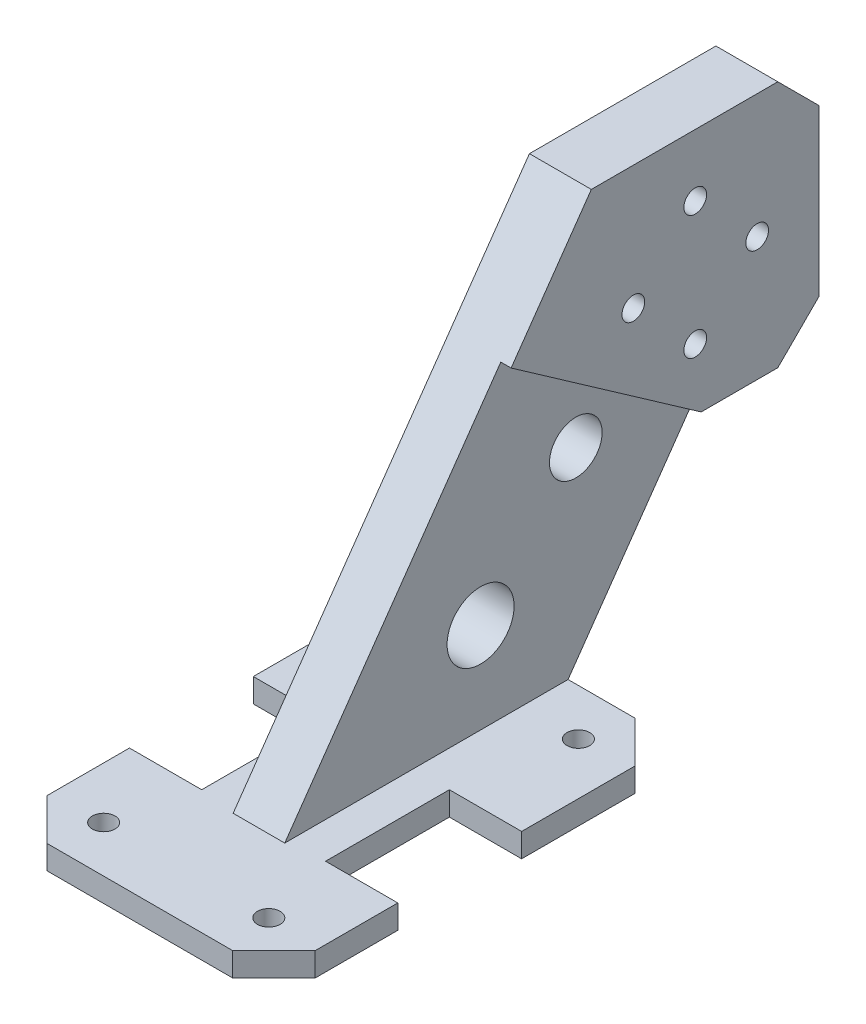
from build123d import *

# Parameters (mm, degrees)
EXTRUDE_1_DEPTH      = 30
SKETCH_2_R           = 8.25
CUT_EXTRUDE_1_DEPTH  = 2.5
EXTRUDE_2_DEPTH      = 41
SKETCH_6_R           = 8
CUT_EXTRUDE_3_DEPTH  = 4
CUT_EXTRUDE_4_DEPTH  = 83.710337927
CUT_EXTRUDE_6_DEPTH  = 23
EXTRUDE_3_DEPTH      = 23
CUT_EXTRUDE_7_DEPTH  = 46.5
EXTRUDE_4_DEPTH      = 4
CUT_EXTRUDE_8_DEPTH  = 23
CUT_EXTRUDE_9_DEPTH  = 65.964988157
SKETCH_16_R          = 1.25
CUT_EXTRUDE_10_DEPTH = 65.964988157
CUT_EXTRUDE_11_DEPTH = 44
EXTRUDE_5_DEPTH      = 2.5
CUT_EXTRUDE_12_DEPTH = 3
EXTRUDE_6_DEPTH      = 41
CUT_EXTRUDE_13_DEPTH = 41
CUT_EXTRUDE_14_DEPTH = 17
CHAMFER_1_SIZE       = 4
CUT_EXTRUDE_16_DEPTH = 53.085522264
EXTRUDE_8_DEPTH      = 5
CUT_EXTRUDE_17_DEPTH = 4
SKETCH_30_W          = 26
SKETCH_30_H          = 39
SKETCH_30_R          = 1.1
EXTRUDE_10_DEPTH     = 2.3
CHAMFER_4_SIZE       = 4
SKETCH_32_R          = 2.551786445
SKETCH_32_R_2        = 3.249198584
CUT_EXTRUDE_18_DEPTH = 48.085687781
SKETCH_33_W          = 7
SKETCH_33_H          = 12
CUT_EXTRUDE_19_DEPTH = 10
EXTRUDE_11_DEPTH     = 1
SKETCH_8_R           = 1.1
CUT_EXTRUDE_5_DEPTH  = 47.322910032


with BuildPart() as part:
    # 草图1 → 凸台-拉伸1 (new body)
    with BuildSketch(Plane(origin=(0, 0, 0), x_dir=(1, 0, 0), z_dir=(0, 1, 0))):
        Polygon((0, 0), (-15.325055808, 0), (-21.84047557, -15.349367059), (5.774670034, -27.071300914), (30, 30), (0, 30), align=None)
    extrude(amount=EXTRUDE_1_DEPTH)

    # 草图2 → 切除-拉伸1 (cut)
    with BuildSketch(Plane.ZY):
        with Locations((-15, 15)):
            Circle(SKETCH_2_R)
    extrude(amount=-CUT_EXTRUDE_1_DEPTH, mode=Mode.SUBTRACT)

    # 草图5 → 凸台-拉伸2 (add)
    with BuildSketch(Plane.XZ):
        Polygon((-21.84047557, 15.349367059), (-9.337079458, -14.106788251), (18.278066145, -2.384854396), (5.774670034, 27.071300914), align=None)
    extrude(amount=EXTRUDE_2_DEPTH)

    # 草图6 → 切除-拉伸3 (cut)
    with BuildSketch(Plane.XZ.offset(41)):
        with Locations(Location((-1.781204712, 6.482256331, 0), (0, 0, 270))):
            Circle(SKETCH_6_R)
    extrude(amount=-CUT_EXTRUDE_3_DEPTH, mode=Mode.SUBTRACT)

    # 草图7 → 切除-拉伸4 (cut, through all)
    with BuildSketch(Plane(origin=(0, 30, 0), x_dir=(1, 0, 0), z_dir=(0, 1, 0))):
        Polygon((0, 27), (5, 27), (5, -28.896309146), (30, 30), (0, 30), align=None)
    extrude(amount=-CUT_EXTRUDE_4_DEPTH, mode=Mode.SUBTRACT)

    # 草图10 → 切除-拉伸6 (cut)
    with BuildSketch(Plane.XZ.offset(41)):
        Polygon((-19.999465863, 16.130829316), (-7.496069751, -13.325325994), (-9.337079458, -14.106788251), (-21.84047557, 15.349367059), align=None)
        Polygon((5.774670034, 27.071300914), (3.933660327, 26.289838657), (16.437056438, -3.166316653), (18.278066145, -2.384854396), align=None)
    extrude(amount=-CUT_EXTRUDE_6_DEPTH, mode=Mode.SUBTRACT)

    # 草图11 → 凸台-拉伸3 (add)
    with BuildSketch(Plane.XZ.offset(41)):
        Polygon((-19.999465863, 16.130829316), (-24.297508276, 26.256382704), (-0.364382087, 36.415392045), (3.933660327, 26.289838657), align=None)
        Polygon((5, 23.777699815), (16.437056438, -3.166316653), (5, -8.021059083), align=None)
    extrude(amount=-EXTRUDE_3_DEPTH)

    # 草图12 → 切除-拉伸7 (cut)
    with BuildSketch(Plane.XZ.offset(41)):
        Polygon((0.345866355, -31.799769722), (-9.058994265, -9.64330658), (14.874131924, 0.51570276), (24.278992544, -21.640760381), align=None)
    extrude(amount=-CUT_EXTRUDE_7_DEPTH, mode=Mode.SUBTRACT)

    # 草图13 → 凸台-拉伸4 (add)
    with BuildSketch(Plane(origin=(0, -18, 0), x_dir=(1, 0, 0), z_dir=(0, 1, 0))):
        Polygon((14.874131924, -0.51570276), (-9.058994265, 9.64330658), (-24.297508276, -26.256382704), (-0.364382087, -36.415392045), align=None)
    extrude(amount=EXTRUDE_4_DEPTH)

    # 草图14 → 切除-拉伸8 (cut)
    with BuildSketch(Plane.XZ.offset(41)):
        Polygon((-9.058994265, -9.64330658), (14.874131924, 0.51570276), (-0.364382087, 36.415392045), (-24.297508276, 26.256382704), align=None)
    extrude(amount=-CUT_EXTRUDE_8_DEPTH, mode=Mode.SUBTRACT)

    # 草图15 → 切除-拉伸9 (cut, through all)
    with BuildSketch(Plane.XZ.offset(18)):
        Polygon((5, 23.777699815), (5, 26.742472994), (3.933660327, 26.289838657), align=None)
        Polygon((-19.999465863, 16.130829316), (-7.496069751, -13.325325994), (-9.337079458, -14.106788251), (-21.84047557, 15.349367059), align=None)
    extrude(amount=-CUT_EXTRUDE_9_DEPTH, mode=Mode.SUBTRACT)

    # 草图16 → 切除-拉伸10 (cut, through all)
    with BuildSketch(Plane.XZ.offset(18)):
        with Locations(Location((-17.936693931, 24.067766506, 0), (0, 0, 270))):
            Circle(SKETCH_16_R)
        with Locations(Location((-3.208616276, 30.319464562, 0), (0, 0, 90))):
            Circle(SKETCH_16_R)
        with Locations(Location((8.513317579, 2.704318958, 0), (0, 0, 270))):
            Circle(SKETCH_16_R)
        with Locations(Location((-6.214760076, -3.547379097, 0), (0, 0, 270))):
            Circle(SKETCH_16_R)
    extrude(amount=-CUT_EXTRUDE_10_DEPTH, mode=Mode.SUBTRACT)

    # 草图17 → 切除-拉伸11 (cut)
    with BuildSketch(Plane(origin=(0, 30, 0), x_dir=(1, 0, 0), z_dir=(0, 1, 0))):
        Polygon((-9.058994265, 9.64330658), (-19.999465863, -16.130829316), (0, -24.620098913), (0, 5.797991655), align=None)
    extrude(amount=-CUT_EXTRUDE_11_DEPTH, mode=Mode.SUBTRACT)

    # 草图18 → 凸台-拉伸5 (add)
    with BuildSketch(Plane.XZ.offset(-5.5)):
        Polygon((5, -3.675617573), (0, -5.797991655), (0, -27), (5, -27), align=None)
    extrude(amount=EXTRUDE_5_DEPTH)

    # 草图20 → 切除-拉伸12 (cut)
    with BuildSketch(Plane(origin=(0, 30, 0), x_dir=(1, 0, 0), z_dir=(0, 1, 0))):
        Polygon((0, 27), (0, -24.620098913), (3.933660327, -26.289838657), (5, -23.777699815), (5, 27), align=None)
    extrude(amount=-CUT_EXTRUDE_12_DEPTH, mode=Mode.SUBTRACT)

    # 草图21 → 凸台-拉伸6 (add)
    with BuildSketch(Plane(origin=(0, 27, 0), x_dir=(1, 0, 0), z_dir=(0, 1, 0))):
        Polygon((0, -24.620098913), (0, -35.556961644), (3.933660327, -26.289838657), align=None)
    extrude(amount=-EXTRUDE_6_DEPTH)

    # 草图22 → 切除-拉伸13 (cut)
    with BuildSketch(Plane(origin=(0, 27, 0), x_dir=(1, 0, 0), z_dir=(0, 1, 0))):
        Polygon((5, -23.777699815), (0, -23.777699815), (0, -35.556961644), align=None)
    extrude(amount=-CUT_EXTRUDE_13_DEPTH, mode=Mode.SUBTRACT)

    # 草图23 → 切除-拉伸14 (cut)
    with BuildSketch(Plane.XZ.offset(-3)):
        Polygon((5, -3.675617573), (0, -3.675617573), (0, -5.797991655), align=None)
    extrude(amount=CUT_EXTRUDE_14_DEPTH, mode=Mode.SUBTRACT)

    # 倒角1
    chamfer_1_edges = [part.edges().sort_by_distance(p)[0] for p in [
        (-24.297508276, -16, 26.256382704),
        (-0.364382087, -16, 36.415392045),
        (14.874131924, -16, 0.51570276),
        (-9.058994265, -16, -9.64330658),
        (2.5, 3, -27),
        (2.5, 27, -27),
    ]]
    chamfer(chamfer_1_edges, length=CHAMFER_1_SIZE)

    # 草图26 → 切除-拉伸16 (cut, through all)
    with BuildSketch(Plane(origin=(5, 0, 0), x_dir=(0, 0, -1), z_dir=(1, 0, 0))):
        Polygon((-23.777699815, -14), (4.930809251, 27), (-23.777699815, 27), align=None)
    extrude(amount=-CUT_EXTRUDE_16_DEPTH, mode=Mode.SUBTRACT)

    # 草图27 → 凸台-拉伸8 (add)
    with BuildSketch(Plane(origin=(5, 0, 0), x_dir=(0, 0, -1), z_dir=(1, 0, 0))):
        Polygon((3.675617573, -14), (15.579145723, 3), (3.675617573, 3), align=None)
    extrude(amount=-EXTRUDE_8_DEPTH)

    # 草图31 → 切除-拉伸17 (cut)
    with BuildSketch(Plane.XZ.offset(18)):
        Polygon((-5.376974851, -8.080382066), (11.192112511, -1.047221754), (13.311207411, 4.197722174), (1.198542427, 32.733372631), (-4.0464015, 34.852467531), (-20.615488863, 27.819307218), (-22.734583762, 22.574363291), (-10.621918779, -5.961287167), align=None)
    extrude(amount=-CUT_EXTRUDE_17_DEPTH, mode=Mode.SUBTRACT)

    # 草图30 → 凸台-拉伸10 (add)
    with BuildSketch(Plane(origin=(0, -14, 0), x_dir=(1, 0, 0), z_dir=(0, 1, 0))):
        with Locations((2.5, -15.824382427)):
            Rectangle(SKETCH_30_W, SKETCH_30_H)
        with Locations(Location((-5.5, -0.824382427, 0), (0, 0, 270))):
            Circle(SKETCH_30_R, mode=Mode.SUBTRACT)
        with Locations(Location((10.5, -0.824382427, 0), (0, 0, 90))):
            Circle(SKETCH_30_R, mode=Mode.SUBTRACT)
        with Locations(Location((10.5, -30.824382427, 0), (0, 0, 270))):
            Circle(SKETCH_30_R, mode=Mode.SUBTRACT)
        with Locations(Location((-5.5, -30.824382427, 0), (0, 0, 90))):
            Circle(SKETCH_30_R, mode=Mode.SUBTRACT)
    extrude(amount=-EXTRUDE_10_DEPTH)

    # 倒角4
    chamfer_4_edges = [part.edges().sort_by_distance(p)[0] for p in [
        (-10.5, -15.15, 35.324382427),
        (-10.5, -15.15, -3.675617573),
        (15.5, -15.15, -3.675617573),
        (15.5, -15.15, 35.324382427),
    ]]
    chamfer(chamfer_4_edges, length=CHAMFER_4_SIZE)

    # 草图32 → 切除-拉伸18 (cut, through all)
    with BuildSketch(Plane.ZY):
        with Locations((-4.425551632, 5.088873795)):
            Circle(SKETCH_32_R)
        with Locations((4.800137825, -5.216417619)):
            Circle(SKETCH_32_R_2)
    extrude(amount=-CUT_EXTRUDE_18_DEPTH, mode=Mode.SUBTRACT)

    # 草图33 → 切除-拉伸19 (cut)
    with BuildSketch(Plane.XZ.offset(16.3)):
        with Locations((-7, 17.324382427)):
            Rectangle(SKETCH_33_W, SKETCH_33_H)
        with Locations((12, 17.324382427)):
            Rectangle(SKETCH_33_W, SKETCH_33_H)
    extrude(amount=-CUT_EXTRUDE_19_DEPTH, mode=Mode.SUBTRACT)

    # 草图34 → 凸台-拉伸11 (add)
    with BuildSketch(Plane(origin=(5, 0, 0), x_dir=(0, 0, -1), z_dir=(1, 0, 0))):
        Polygon((15.579145723, 3), (-2.842306745, 15.898839883), (4.930809251, 27), (23, 27), (27, 23), (27, 7), (23, 3), align=None)
    extrude(amount=EXTRUDE_11_DEPTH)

    # 草图8 → 切除-拉伸5 (cut, through all)
    with BuildSketch(Plane.ZY.offset(-2.5)):
        with Locations((-15, 21)):
            Circle(SKETCH_8_R)
        with Locations((-9, 15)):
            Circle(SKETCH_8_R)
        with Locations(Location((-15, 9, 0), (0, 0, 180))):
            Circle(SKETCH_8_R)
        with Locations(Location((-21, 15, 0), (0, 0, 180))):
            Circle(SKETCH_8_R)
    extrude(amount=-CUT_EXTRUDE_5_DEPTH, mode=Mode.SUBTRACT)


solid = part.part
